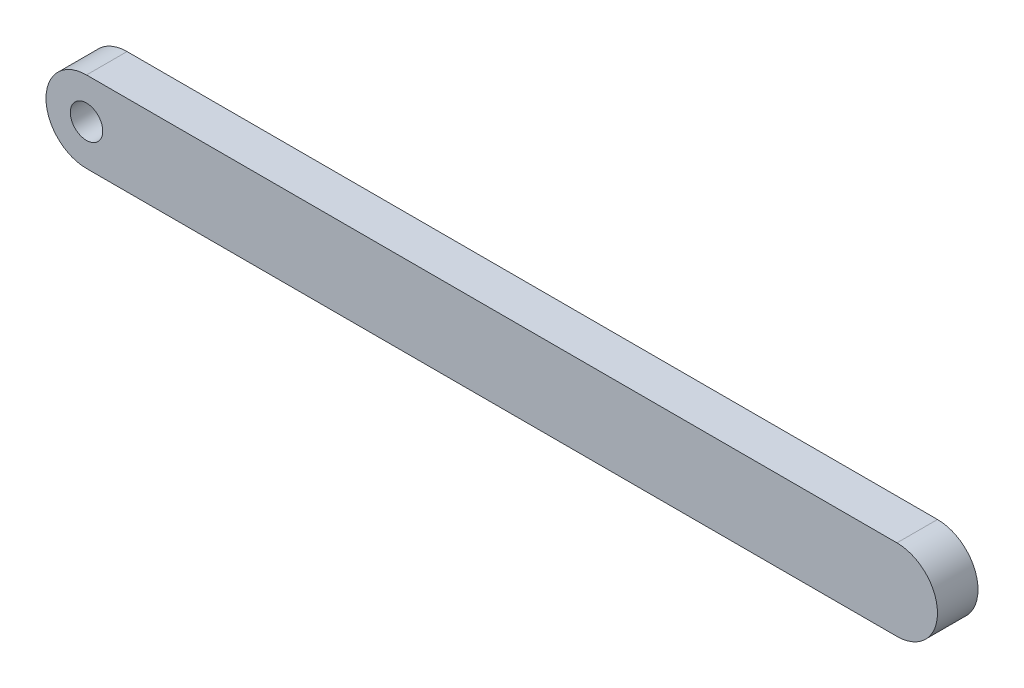
from build123d import *

# Parameters (mm, degrees)
SKETCH1_W           = 100
SKETCH1_H           = 10
BOSS_EXTRUDE1_DEPTH = 5
SKETCH2_R           = 2
CUT_EXTRUDE1_DEPTH  = 106.59356041


with BuildPart() as part:
    # Sketch1 → Boss-Extrude1 (new body)
    with BuildSketch(Plane.XY):
        with BuildLine():
            Line((0, 0), (0, -10))
            ThreePointArc((0, -10), (-5, -5), (0, 0))
        make_face()
        with Locations((50, -5)):
            Rectangle(SKETCH1_W, SKETCH1_H)
        with BuildLine():
            ThreePointArc((100, 0), (105, -5), (100, -10))
            Line((100, -10), (100, 0))
        make_face()
    extrude(amount=BOSS_EXTRUDE1_DEPTH)

    # Sketch2 → Cut-Extrude1 (cut, through all)
    with BuildSketch(Plane.XY.offset(5)):
        with Locations((0, -5)):
            Circle(SKETCH2_R)
    extrude(amount=-CUT_EXTRUDE1_DEPTH, mode=Mode.SUBTRACT)


solid = part.part
